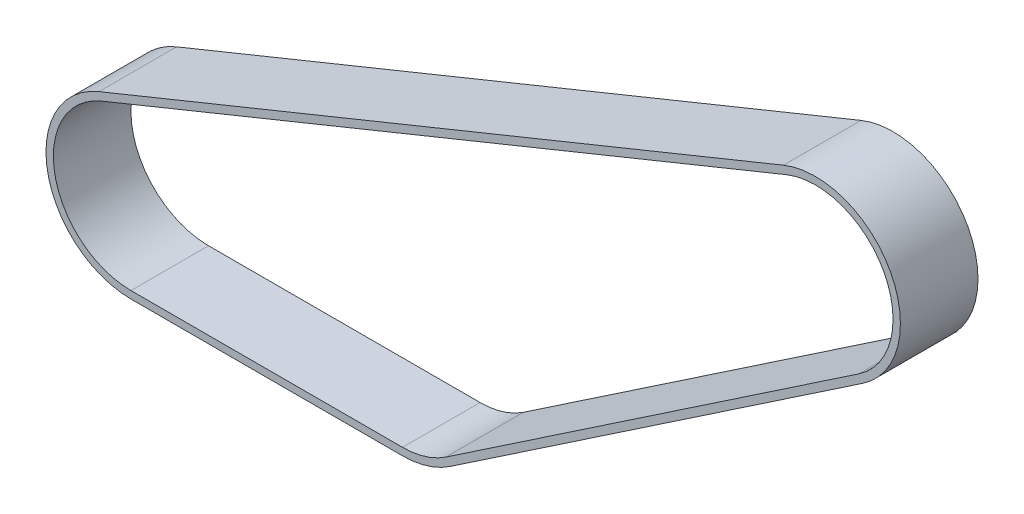
from build123d import *

# Parameters (mm, degrees)
EXTRUDE_1_DEPTH = 50


with BuildPart() as part:
    # 스케치2 → 보스-돌출1 (new body)
    with BuildSketch(Plane.XY):
        with BuildLine():
            Line((-241.197082179, -39.036417247), (199.923978611, 140.464504767))
            ThreePointArc((199.923978611, 140.464504767), (268.871700929, 115.515016226), (251.177460246, 44.358995835))
            Line((251.177460246, 44.358995835), (-14.943600544, -135.14192618))
            ThreePointArc((-14.943600544, -135.14192618), (-29.552594818, -142.110059006), (-45.560530395, -144.502461007))
            Line((-45.560530395, -144.502461007), (-220.560530395, -144.502461007))
            ThreePointArc((-220.560530395, -144.502461007), (-274.293559474, -100.264408412), (-241.197082179, -39.036417247))
        make_face()
        with BuildLine():
            Line((-220.560530395, -139.750461007), (-45.560530395, -139.750461007))
            ThreePointArc((-45.560530395, -139.750461007), (-30.941945159, -137.565698805), (-17.600885222, -131.202339635))
            Line((-17.600885222, -131.202339635), (248.520175569, 48.298582379))
            ThreePointArc((248.520175569, 48.298582379), (264.678709214, 113.278875694), (201.715052802, 136.062964441))
            Line((201.715052802, 136.062964441), (-239.406007988, -43.437957574))
            ThreePointArc((-239.406007988, -43.437957574), (-269.629997336, -99.351888722), (-220.560530395, -139.750461007))
        make_face(mode=Mode.SUBTRACT)
    extrude(amount=EXTRUDE_1_DEPTH)


solid = part.part
